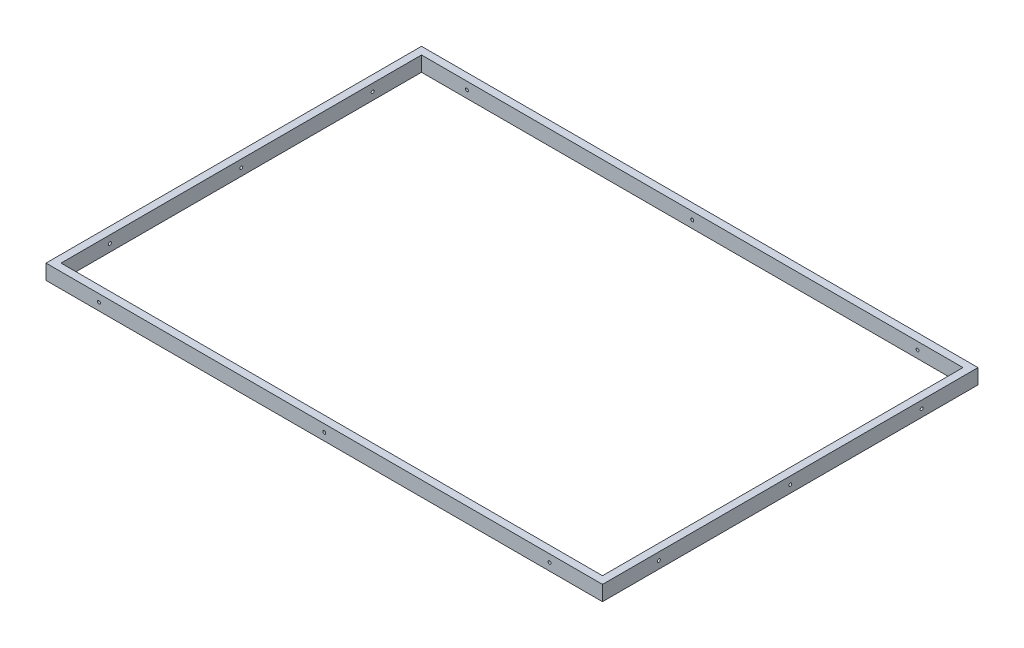
from build123d import *

# Parameters (mm, degrees)
SKETCH_1_W          = 148.2
SKETCH_1_H          = 100
SKETCH_1_W_2        = 144.2
SKETCH_1_H_2        = 96
EXTRUDE_1_DEPTH     = 4
SKETCH_2_R          = 0.4
CUT_EXTRUDE_1_DEPTH = 125.526342595
SKETCH_3_R          = 0.4
CUT_EXTRUDE_2_DEPTH = 157.458428984


with BuildPart() as part:
    # 草图1 → 凸台-拉伸1 (new body)
    with BuildSketch(Plane(origin=(0, 0, 0), x_dir=(1, 0, 0), z_dir=(0, 1, 0))):
        Rectangle(SKETCH_1_W, SKETCH_1_H)
        Rectangle(SKETCH_1_W_2, SKETCH_1_H_2, mode=Mode.SUBTRACT)
    extrude(amount=EXTRUDE_1_DEPTH)

    # 草图2 → 切除-拉伸1 (cut, through all)
    with BuildSketch(Plane.XY.offset(50)):
        with Locations((0, 2)):
            Circle(SKETCH_2_R)
        with Locations((-60, 2)):
            Circle(SKETCH_2_R)
        with Locations((60, 2)):
            Circle(SKETCH_2_R)
    extrude(amount=-CUT_EXTRUDE_1_DEPTH, mode=Mode.SUBTRACT)

    # 草图3 → 切除-拉伸2 (cut, through all)
    with BuildSketch(Plane.ZY.offset(74.1)):
        with Locations((0, 2)):
            Circle(SKETCH_3_R)
        with Locations((35, 2)):
            Circle(SKETCH_3_R)
        with Locations((-35, 2)):
            Circle(SKETCH_3_R)
    extrude(amount=-CUT_EXTRUDE_2_DEPTH, mode=Mode.SUBTRACT)


solid = part.part
